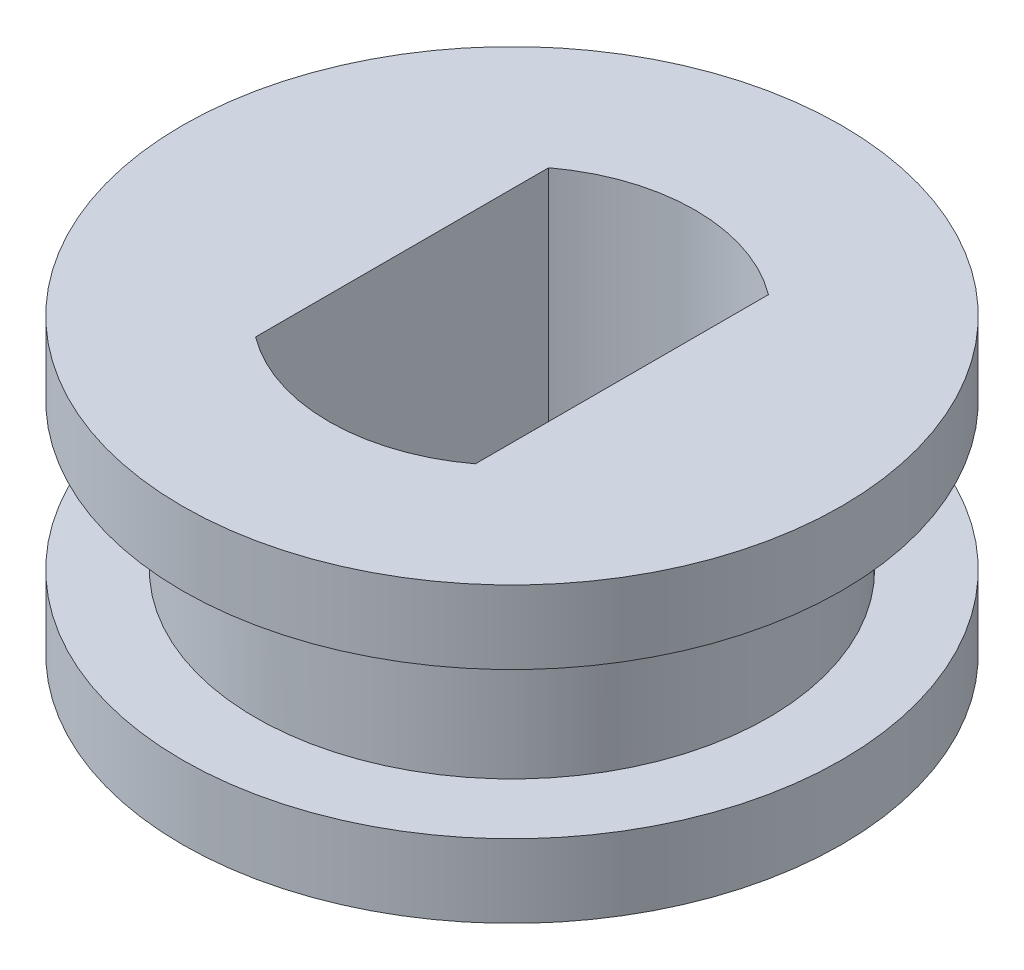
from build123d import *

# Parameters (mm, degrees)
SKETCH1_R           = 3.5
BOSS_EXTRUDE1_DEPTH = 4
BOSS_EXTRUDE2_START = -1
SKETCH2_R           = 4.5
SKETCH2_R_2         = 3.5
BOSS_EXTRUDE2_DEPTH = 1
SKETCH3_R           = 4.5
SKETCH3_R_2         = 3.5
BOSS_EXTRUDE4_DEPTH = 1


with BuildPart() as part:
    # Sketch1 → Boss-Extrude1 (new body)
    with BuildSketch(Plane(origin=(0, 0, 0), x_dir=(1, 0, 0), z_dir=(0, 1, 0))):
        with Locations(Location((0, 0, 0), (0, 0, 270))):
            Circle(SKETCH1_R)
        with BuildLine():
            Line((-1.5, 2), (-1.5, -2))
            ThreePointArc((-1.5, -2), (0, -2.5), (1.5, -2))
            Line((1.5, -2), (1.5, 2))
            ThreePointArc((1.5, 2), (0, 2.5), (-1.5, 2))
        make_face(mode=Mode.SUBTRACT)
    extrude(amount=BOSS_EXTRUDE1_DEPTH)

    # Sketch2 → Boss-Extrude2 (add)
    with BuildSketch(Plane(origin=(0, 4, 0), x_dir=(1, 0, 0), z_dir=(0, 1, 0)).offset(BOSS_EXTRUDE2_START)):
        with Locations(Location((0, 0, 0), (0, 0, 270))):
            Circle(SKETCH2_R)
        with Locations(Location((0, 0, 0), (0, 0, 270))):
            Circle(SKETCH2_R_2, mode=Mode.SUBTRACT)
    extrude(amount=BOSS_EXTRUDE2_DEPTH)

    # Sketch3 → Boss-Extrude4 (add)
    with BuildSketch(Plane.XZ):
        with Locations(Location((0, 0, 0), (0, 0, 90))):
            Circle(SKETCH3_R)
        with Locations(Location((0, 0, 0), (0, 0, 270))):
            Circle(SKETCH3_R_2, mode=Mode.SUBTRACT)
    extrude(amount=-BOSS_EXTRUDE4_DEPTH)


solid = part.part
